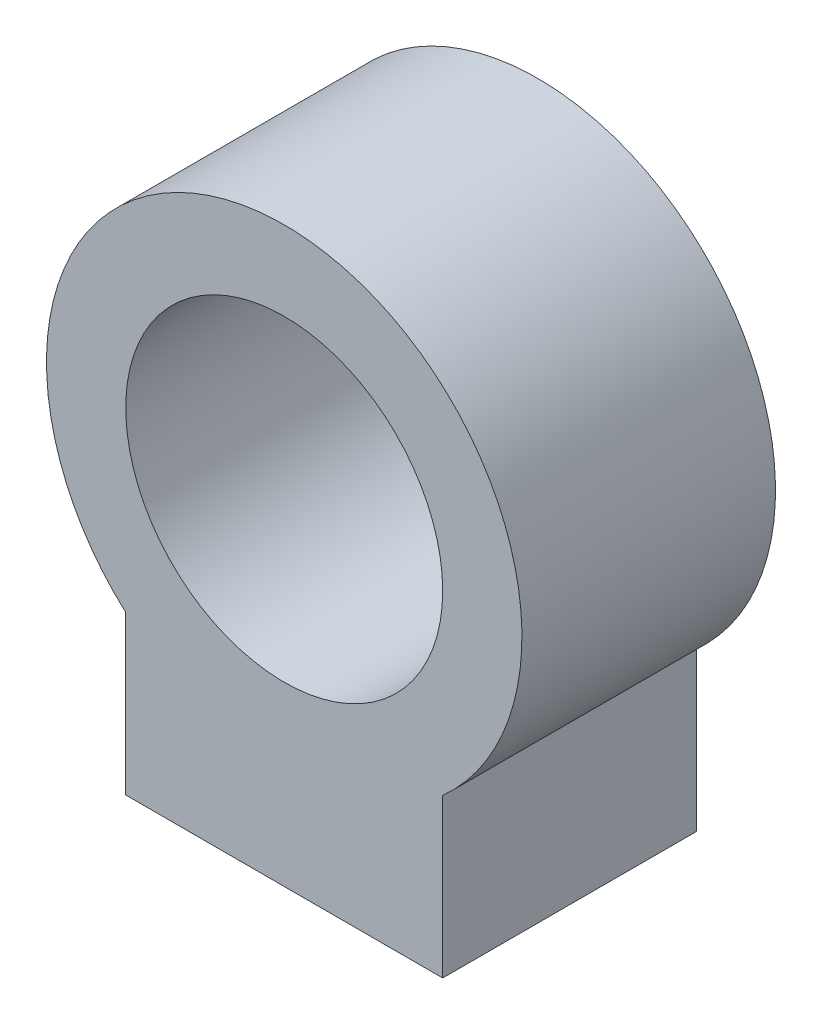
from build123d import *

# Parameters (mm, degrees)
SKETCH1_W                = 50
SKETCH1_H                = 40
BOSS_EXTRUDE1_DEPTH      = 25
BOSS_EXTRUDE2_DEPTH      = 20
BOSS_EXTRUDE2_DEPTH_BACK = 20
SKETCH2_R                = 37.5
CUT_EXTRUDE1_DEPTH       = 20
CUT_EXTRUDE1_DEPTH_BACK  = 20
SKETCH3_R                = 25


with BuildPart() as part:
    # Sketch1 → Boss-Extrude1 (new body)
    with BuildSketch(Plane(origin=(0, 0, 0), x_dir=(1, 0, 0), z_dir=(0, 1, 0))):
        Rectangle(SKETCH1_W, SKETCH1_H)
    extrude(amount=BOSS_EXTRUDE1_DEPTH)

    # Sketch2 → Boss-Extrude2 (add, two sides: drawn at the far end of the back side and taken through both)
    with BuildSketch(Plane.XY.offset(-BOSS_EXTRUDE2_DEPTH_BACK)):
        with Locations((0, 52.9)):
            Circle(SKETCH2_R)
    extrude(amount=BOSS_EXTRUDE2_DEPTH + BOSS_EXTRUDE2_DEPTH_BACK)

    # Sketch3 → Cut-Extrude1 (cut, two sides: drawn at the far end of the back side and taken through both)
    with BuildSketch(Plane.XY.offset(-CUT_EXTRUDE1_DEPTH_BACK)):
        with Locations((0, 52.9)):
            Circle(SKETCH3_R)
    extrude(amount=CUT_EXTRUDE1_DEPTH + CUT_EXTRUDE1_DEPTH_BACK, mode=Mode.SUBTRACT)


solid = part.part
